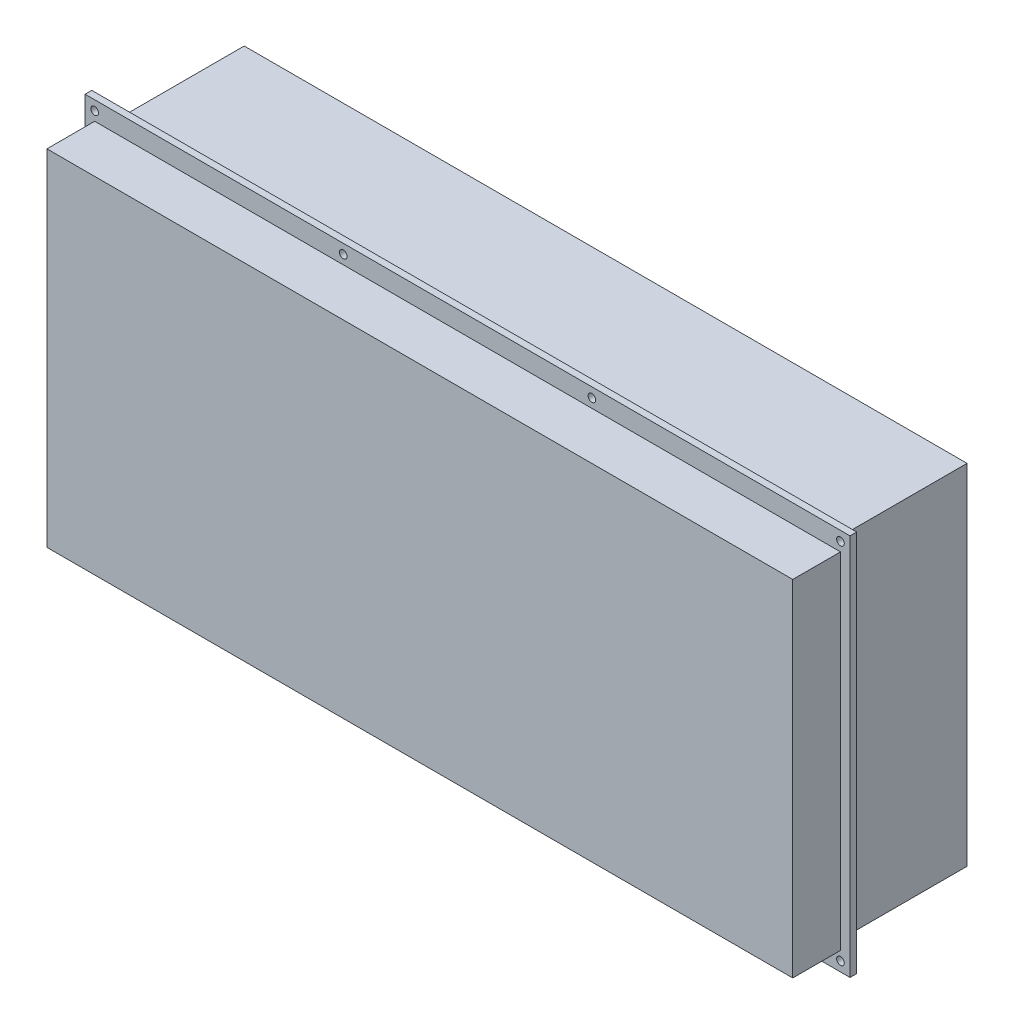
from build123d import *

# Parameters (mm, degrees)
IZIM1_W                     = 400
IZIM1_H                     = 200
IZIM1_R                     = 2
Y_KSEKLIK_EKSTR_ZYON1_DEPTH = 1.75
IZIM2_W                     = 390
IZIM2_H                     = 180.5
Y_KSEKLIK_EKSTR_ZYON2_DEPTH = 24.953
IZIM4_W                     = 378
IZIM4_H                     = 182.48
Y_KSEKLIK_EKSTR_ZYON4_DEPTH = 68.7


with BuildPart() as part:
    # Çizim1 → Yükseklik-Ekstrüzyon1 (new, symmetric)
    with BuildSketch(Plane.XY):
        Rectangle(IZIM1_W, IZIM1_H)
        with Locations((-195, 95)):
            Circle(IZIM1_R, mode=Mode.SUBTRACT)
        with Locations((-65, 95)):
            Circle(IZIM1_R, mode=Mode.SUBTRACT)
        with Locations((65, 95)):
            Circle(IZIM1_R, mode=Mode.SUBTRACT)
        with Locations((195, 95)):
            Circle(IZIM1_R, mode=Mode.SUBTRACT)
        with Locations((-65, -95)):
            Circle(IZIM1_R, mode=Mode.SUBTRACT)
        with Locations((65, -95)):
            Circle(IZIM1_R, mode=Mode.SUBTRACT)
        with Locations((195, -95)):
            Circle(IZIM1_R, mode=Mode.SUBTRACT)
        with Locations((-195, -95)):
            Circle(IZIM1_R, mode=Mode.SUBTRACT)
    extrude(amount=Y_KSEKLIK_EKSTR_ZYON1_DEPTH, both=True)

    # Çizim2 → Yükseklik-Ekstrüzyon2 (add)
    with BuildSketch(Plane.XY.offset(1.75)):
        Rectangle(IZIM2_W, IZIM2_H)
    extrude(amount=Y_KSEKLIK_EKSTR_ZYON2_DEPTH)

    # Çizim4 → Yükseklik-Ekstrüzyon4 (add)
    with BuildSketch(Plane(origin=(0, 0, -1.75), x_dir=(-1, 0, 0), z_dir=(0, 0, -1))):
        Rectangle(IZIM4_W, IZIM4_H)
    extrude(amount=Y_KSEKLIK_EKSTR_ZYON4_DEPTH)


solid = part.part
